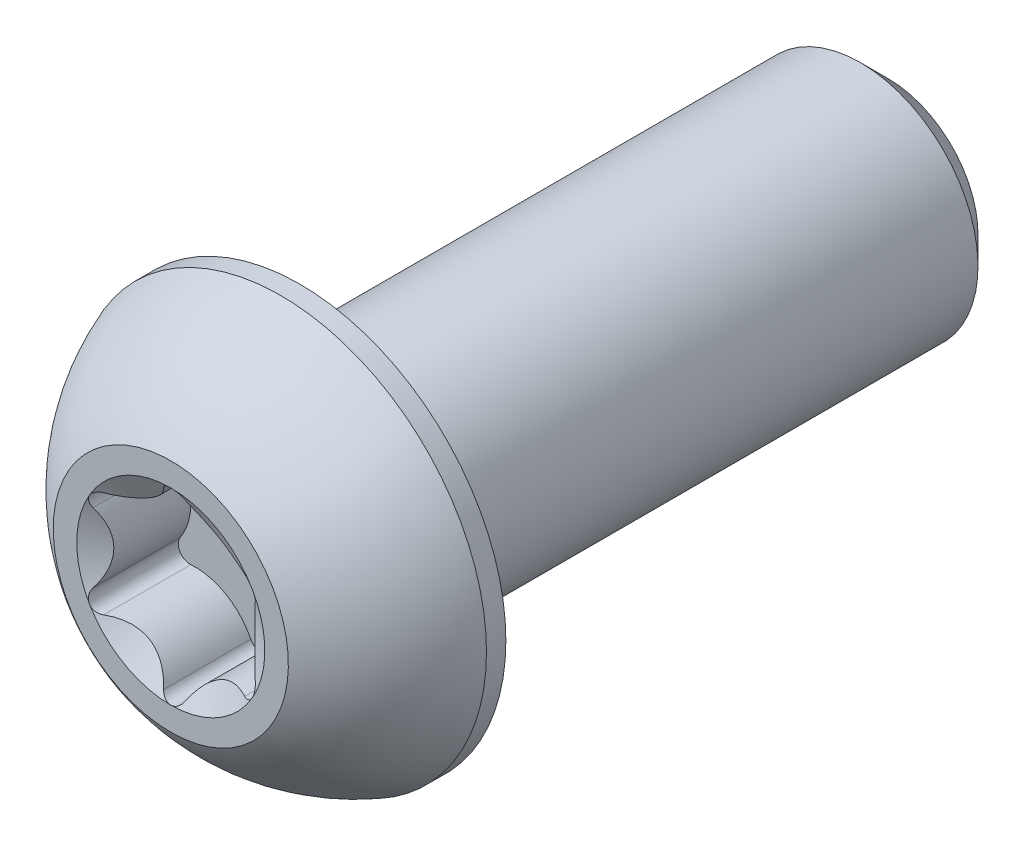
from build123d import *

# Parameters (mm, degrees)
SKETCH1_W          = 20
SKETCH1_H          = 4
CHAMFER1_SIZE      = 0.9375
CUT_EXTRUDE4_DEPTH = 3.08
CIRPATTERN1_COUNT  = 6


with BuildPart() as part:
    # Sketch1 → Revolve1 (revolve)
    with BuildSketch(Plane(origin=(0, 0, 0), x_dir=(0, 0, -1), z_dir=(1, 0, 0))):
        with Locations((14.4, 2)):
            Rectangle(SKETCH1_W, SKETCH1_H)
    revolve(axis=Axis((0, 0, -24.4), (0, 0, 1)))

    # Chamfer1
    chamfer1_edges = [part.edges().sort_by_distance(p)[0] for p in [
        (0, -4, -24.4),
    ]]
    chamfer(chamfer1_edges, length=CHAMFER1_SIZE)

    # Sketch7 → Revolve2 (revolve)
    with BuildSketch(Plane(origin=(0, 0, 0), x_dir=(0, 0, -1), z_dir=(1, 0, 0))):
        with BuildLine():
            Line((3.74, 7), (4.4, 7))
            Line((4.4, 7), (4.4, 0))
            Line((4.4, 0), (0, 0))
            Line((0, 0), (0, 4))
            ThreePointArc((0, 4), (1.621972026, 5.809208208), (3.74, 7))
        make_face()
    revolve(axis=Axis((0, 0, 0), (0, 0, -1)))

    # Sketch11 → Cut-Extrude4 (cut)
    with BuildSketch(Plane.XY):
        with BuildLine():
            Line((0, 0), (-2.771281292, 1.6))
            ThreePointArc((-2.771281292, 1.6), (-2.824655372, 1.386863789), (-2.75740496, 1.177691088))
            ThreePointArc((-2.75740496, 1.177691088), (-2.4, 0), (-2.75740496, -1.177691088))
            ThreePointArc((-2.75740496, -1.177691088), (-2.824655372, -1.386863789), (-2.771281292, -1.6))
            Line((-2.771281292, -1.6), (0, 0))
        make_face()
    cut_extrude4 = extrude(amount=-CUT_EXTRUDE4_DEPTH, mode=Mode.SUBTRACT)

    # CirPattern1: Cut-Extrude4 ×6 about axis
    cirpattern1_axis = Axis((0, 0, 0), (0, 0, -1))
    for i in range(1, CIRPATTERN1_COUNT):
        add(cut_extrude4.rotate(cirpattern1_axis, i * 360 / CIRPATTERN1_COUNT), mode=Mode.SUBTRACT)

    # Cut-Extrude3 cone 1 section (through the dimple's axis) → Cut-Extrude3 (revolve, cut)
    with BuildSketch(Plane(origin=(0, 0, 0), x_dir=(0, -1, 0), z_dir=(1, 0, 0))):
        Polygon((0, 0), (3.2, 0), (0, 1.847520861), align=None)
    revolve(axis=Axis((0, 0, 0), (0, 0, -1)), mode=Mode.SUBTRACT)


solid = part.part
